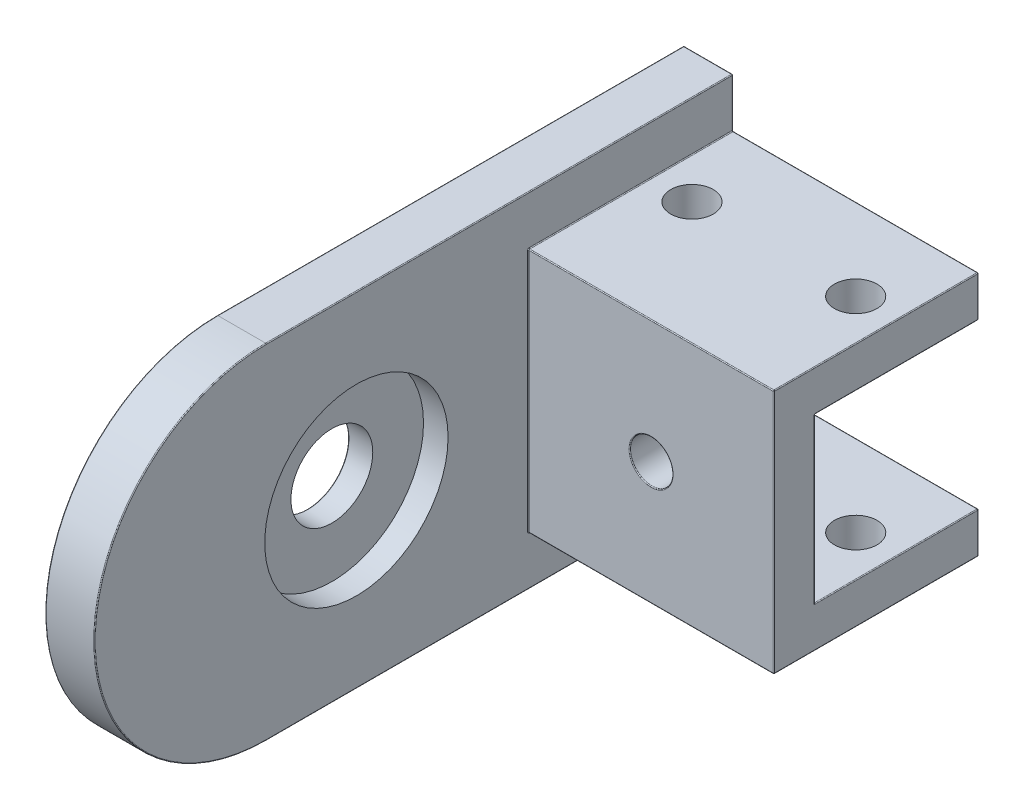
from build123d import *

# Parameters (mm, degrees)
BOSS_EXTRUDE1_DEPTH = 6.000000983
SKETCH2_W           = 24.999999441
SKETCH2_H           = 29.999998398
BOSS_EXTRUDE2_DEPTH = 29.999997467
SKETCH3_W           = 19.999999553
SKETCH3_H           = 19.999999553
CUT_EXTRUDE1_DEPTH  = 81.149858764
SKETCH14_R          = 11.2
CUT_EXTRUDE12_DEPTH = 3
SKETCH15_R          = 2.6
CUT_EXTRUDE13_DEPTH = 102.435737903
SKETCH19_R          = 2.6
CUT_EXTRUDE15_DEPTH = 102.00598463
SKETCH22_R          = 5
CUT_EXTRUDE16_DEPTH = 10
FILLET1_R           = 0.1


with BuildPart() as part:
    # Sketch1 → Boss-Extrude1 (new body)
    with BuildSketch(Plane(origin=(45.028056949, 0, 0), x_dir=(0, 0, -1), z_dir=(1, 0, 0))):
        with BuildLine():
            Line((-37.000000447, 0), (19.999999553, 0))
            Line((19.999999553, 0), (19.999999553, 41.999999434))
            Line((19.999999553, 41.999999434), (-37.000000447, 41.999999434))
            ThreePointArc((-37.000000447, 41.999999434), (-58.000000164, 20.999999717), (-37.000000447, 0))
        make_face()
    extrude(amount=-BOSS_EXTRUDE1_DEPTH)

    # Sketch2 → Boss-Extrude2 (add)
    with BuildSketch(Plane(origin=(45.028056949, 0, 0), x_dir=(0, 0, -1), z_dir=(1, 0, 0))):
        with Locations((7.499999833, 20.999999251)):
            Rectangle(SKETCH2_W, SKETCH2_H)
    extrude(amount=BOSS_EXTRUDE2_DEPTH)

    # Sketch3 → Cut-Extrude1 (cut, through all)
    with BuildSketch(Plane.ZY.offset(-39.028055966)):
        with Locations((-9.999999777, 20.999999716)):
            Rectangle(SKETCH3_W, SKETCH3_H)
    extrude(amount=-CUT_EXTRUDE1_DEPTH, mode=Mode.SUBTRACT)

    # Sketch14 → Cut-Extrude12 (cut)
    with BuildSketch(Plane(origin=(45.028056949, 0, 0), x_dir=(0, 0, -1), z_dir=(1, 0, 0))):
        with Locations((-25.999999888, 20.999999717)):
            Circle(SKETCH14_R)
    extrude(amount=-CUT_EXTRUDE12_DEPTH, mode=Mode.SUBTRACT)

    # Sketch15 → Cut-Extrude13 (cut, through all)
    with BuildSketch(Plane(origin=(0, 6.000000052, 0), x_dir=(-1, 0, 0), z_dir=(0, -1, 0))):
        with Locations(Location((-50.028056949, 9.999999553, 0), (0, 0, 90))):
            Circle(SKETCH15_R)
        with Locations(Location((-70.028056949, 9.999999553, 0), (0, 0, 90))):
            Circle(SKETCH15_R)
    extrude(amount=-CUT_EXTRUDE13_DEPTH, mode=Mode.SUBTRACT)

    # Sketch19 → Cut-Extrude15 (cut, through all)
    with BuildSketch(Plane.XY.offset(4.999999888)):
        with Locations((60.028055683, 20.999999251)):
            Circle(SKETCH19_R)
    extrude(amount=-CUT_EXTRUDE15_DEPTH, mode=Mode.SUBTRACT)

    # Sketch22 → Cut-Extrude16 (cut)
    with BuildSketch(Plane(origin=(42.028056949, 0, 0), x_dir=(0, 0, -1), z_dir=(1, 0, 0))):
        with Locations((-25.999999888, 20.999999717)):
            Circle(SKETCH22_R)
    extrude(amount=-CUT_EXTRUDE16_DEPTH, mode=Mode.SUBTRACT)

    # Fillet1
    fillet1_edges = [part.edges().sort_by_distance(p)[0] for p in [
        (39.028055966, 20.999999717, 58.000000164),
        (45.028056949, 38.999998942, -19.999999553),
        (45.028056949, 35.99999845, -7.499999832),
        (39.028055966, 0, 8.500000447),
        (60.028055683, 35.99999845, -19.999999553),
        (45.028056949, 20.999999251, 4.999999888),
        (60.028055683, 35.99999845, 4.999999888),
        (45.028056949, 6.000000052, -7.499999832),
        (60.028055683, 6.000000052, 4.999999888),
        (60.028055683, 6.000000052, -19.999999553),
        (75.028054416, 35.99999845, -7.499999832),
        (75.028054416, 20.999999251, 4.999999888),
        (75.028054416, 6.000000052, -7.499999832),
        (75.028054416, 8.499999996, -19.999999553),
        (75.028054416, 33.499998972, -19.999999553),
        (39.028055966, 36.499999464, -19.999999553),
        (75.028054416, 30.999999493, -9.999999776),
        (57.028055191, 30.999999493, -19.999999553),
        (75.028054416, 20.999999717, 0),
        (57.028055191, 30.999999493, 0),
        (75.028054416, 10.99999994, -9.999999776),
        (57.028055191, 10.99999994, -19.999999553),
        (39.028055966, 30.999999493, -9.999999776),
        (39.028055966, 10.99999994, -9.999999776),
        (39.028055966, 20.999999717, 0),
        (39.028055966, 5.49999997, -19.999999553),
        (45.028056949, 0, 8.500000447),
        (45.028056949, 20.999999717, 58.000000164),
        (50.028056949, 30.999999493, -7.399999553),
        (45.028056949, 41.999999434, 8.500000447),
        (70.028056949, 30.999999493, -7.399999553),
        (45.028056949, 3.000000026, -19.999999553),
        (57.428055683, 20.999999251, 4.999999888),
        (39.028055966, 20.999999717, 30.999999888),
        (42.028056458, 0, -19.999999553),
        (42.028056458, 41.999999434, -19.999999553),
        (39.028055966, 41.999999434, 8.500000447),
    ]]
    fillet(fillet1_edges, radius=FILLET1_R)


solid = part.part
